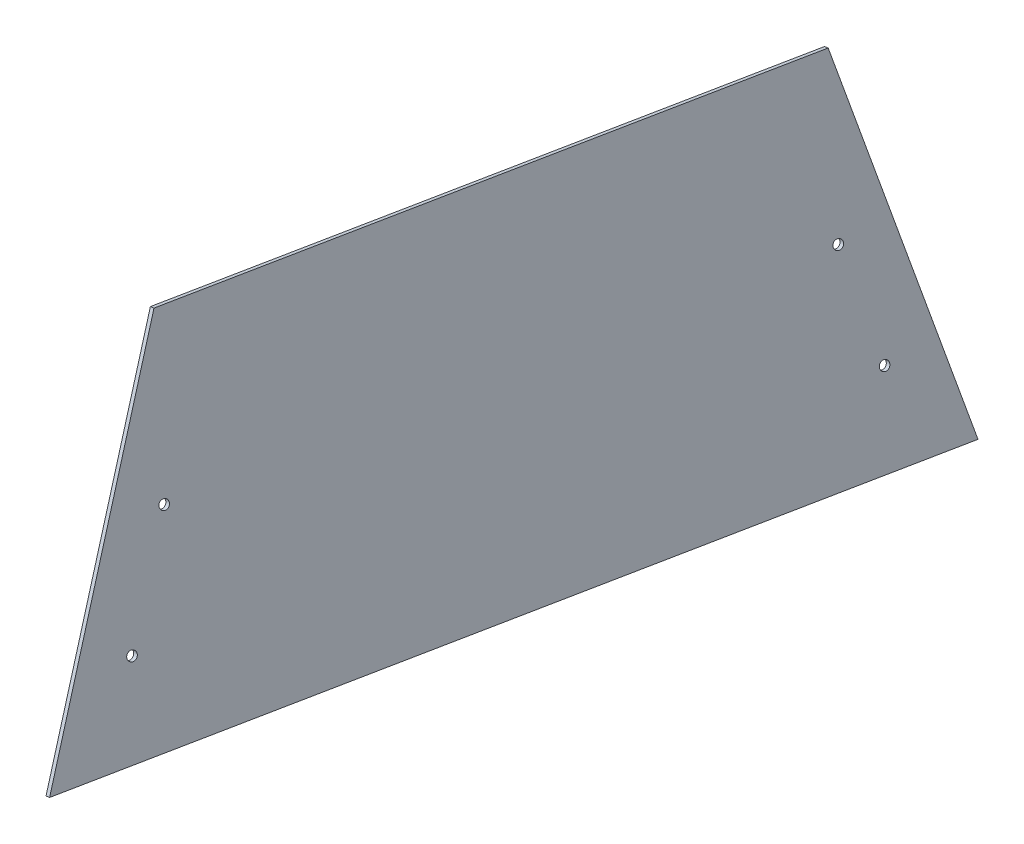
from build123d import *

# Parameters (mm, degrees)
BOSS_EXTRUDE1_DEPTH     = 3
CUT_EXTRUDE1_DEPTH      = 1894.152557487
CUT_EXTRUDE1_DEPTH_BACK = 1894.152557487
SKETCH3_R               = 2.75


with BuildPart() as part:
    # Sketch1 → Boss-Extrude1 (new body)
    with BuildSketch(Plane(origin=(661.48611704, 211.228421756, 131.566142626), x_dir=(0.17733557040624817, 0.05662751143705051, -0.9825199338523047), z_dir=(0.9359591821601212, 0.2988742708017776, 0.1861574053935612))):
        Polygon((-1711.561008488, 536.583768948), (-1818.35898353, 342.579279309), (-1328.661052703, 313.46937198), (-1355.956557086, 515.444997525), align=None)
    extrude(amount=BOSS_EXTRUDE1_DEPTH)

    # Sketch3 → Cut-Extrude1 (cut, two sides: drawn at the far end of the back side and taken through both)
    with BuildSketch(Plane(origin=(661.48611704, 211.228421756, 131.566142626), x_dir=(0.17733557040624817, 0.05662751143705051, -0.9825199338523047), z_dir=(0.9359591821601212, 0.2988742708017776, 0.1861574053935612)).offset(-CUT_EXTRUDE1_DEPTH_BACK)):
        with Locations(Location((-1729.277570286, 448.219803938, 0), (0, 0, 90))):
            Circle(SKETCH3_R)
        with Locations(Location((-1762.245431769, 388.21613765, 0), (0, 0, 90))):
            Circle(SKETCH3_R)
        with Locations(Location((-1365.280056563, 364.618681835, 0), (0, 0, 90))):
            Circle(SKETCH3_R)
        with Locations(Location((-1373.721769773, 427.083924548, 0), (0, 0, 90))):
            Circle(SKETCH3_R)
    extrude(amount=CUT_EXTRUDE1_DEPTH + CUT_EXTRUDE1_DEPTH_BACK, mode=Mode.SUBTRACT)


solid = part.part
